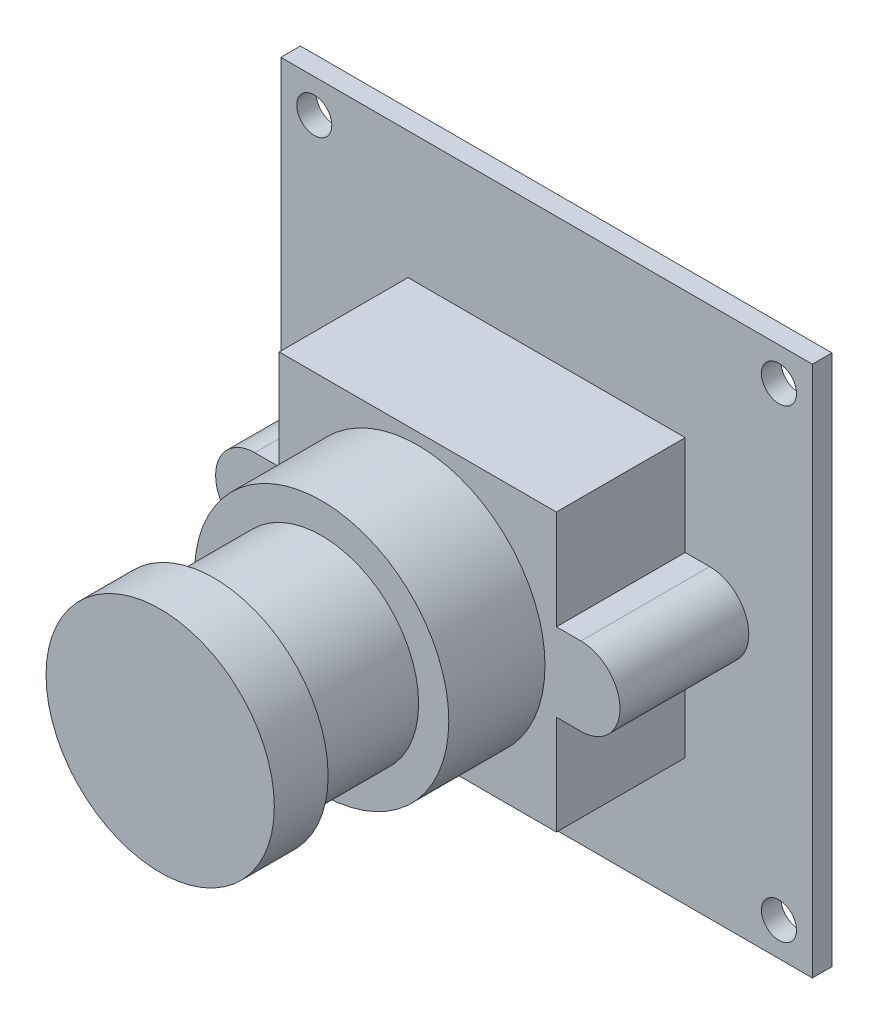
from build123d import *

# Parameters (mm, degrees)
SKETCH1_W           = 32.6
SKETCH1_H           = 32.6
BOSS_EXTRUDE1_DEPTH = 1.2
SKETCH3_R           = 1.075
CUT_EXTRUDE1_DEPTH  = 24.082894099
SKETCH4_W           = 17
SKETCH4_H           = 17
BOSS_EXTRUDE2_DEPTH = 7.9
BOSS_EXTRUDE3_DEPTH = 7.9
SKETCH6_R           = 7.8
BOSS_EXTRUDE4_DEPTH = 5.9
SKETCH7_R           = 5.95
BOSS_EXTRUDE5_DEPTH = 6.6
SKETCH8_R           = 7
BOSS_EXTRUDE6_DEPTH = 3.3


with BuildPart() as part:
    # Sketch1 → Boss-Extrude1 (new body)
    with BuildSketch(Plane.XY):
        Rectangle(SKETCH1_W, SKETCH1_H)
    extrude(amount=BOSS_EXTRUDE1_DEPTH)

    # Sketch3 → Cut-Extrude1 (cut, through all)
    with BuildSketch(Plane.XY.offset(1.2)):
        with Locations((-14.25, 14.25)):
            Circle(SKETCH3_R)
        with Locations((14.25, 14.25)):
            Circle(SKETCH3_R)
        with Locations((14.25, -14.25)):
            Circle(SKETCH3_R)
        with Locations((-14.25, -14.25)):
            Circle(SKETCH3_R)
    extrude(amount=-CUT_EXTRUDE1_DEPTH, mode=Mode.SUBTRACT)

    # Sketch4 → Boss-Extrude2 (add)
    with BuildSketch(Plane.XY.offset(1.2)):
        Rectangle(SKETCH4_W, SKETCH4_H)
    extrude(amount=BOSS_EXTRUDE2_DEPTH)

    # Sketch5 → Boss-Extrude3 (add)
    with BuildSketch(Plane.XY.offset(1.2)):
        with BuildLine():
            Line((-10, 2.4), (10, 2.4))
            ThreePointArc((10, 2.4), (12.4, 0), (10, -2.4))
            Line((10, -2.4), (-10, -2.4))
            ThreePointArc((-10, -2.4), (-12.4, 0), (-10, 2.4))
        make_face()
    extrude(amount=BOSS_EXTRUDE3_DEPTH)

    # Sketch6 → Boss-Extrude4 (add)
    with BuildSketch(Plane.XY.offset(9.1)):
        Circle(SKETCH6_R)
    extrude(amount=BOSS_EXTRUDE4_DEPTH)

    # Sketch7 → Boss-Extrude5 (add)
    with BuildSketch(Plane.XY.offset(15)):
        Circle(SKETCH7_R)
    extrude(amount=BOSS_EXTRUDE5_DEPTH)

    # Sketch8 → Boss-Extrude6 (add)
    with BuildSketch(Plane.XY.offset(21.6)):
        Circle(SKETCH8_R)
    extrude(amount=BOSS_EXTRUDE6_DEPTH)


solid = part.part
